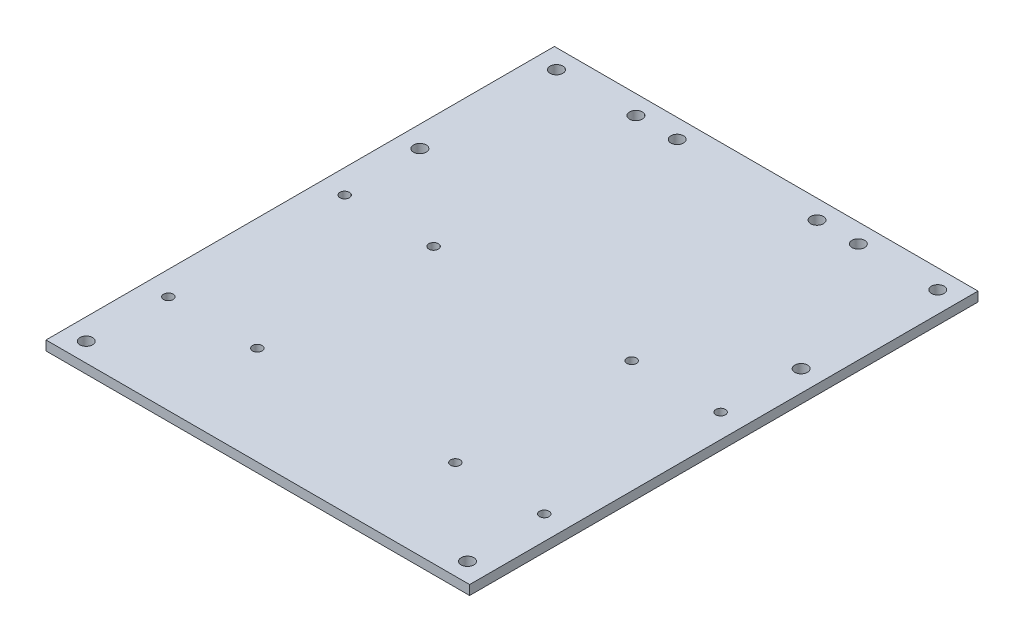
from build123d import *

# Parameters (mm, degrees)
ESQUISSE1_W             = 133.33
ESQUISSE1_H             = 160
BOSS_EXTRU_1_DEPTH      = 3
ESQUISSE2_R             = 2
ENL_V_MAT_EXTRU_1_DEPTH = 105.178799307
ESQUISSE3_R             = 2
ESQUISSE3_R_2           = 1.5
ENL_V_MAT_EXTRU_2_DEPTH = 105.178799307
ESQUISSE4_R             = 2
ENL_V_MAT_EXTRU_3_DEPTH = 3.175
ESQUISSE5_R             = 2
ENL_V_MAT_EXTRU_4_DEPTH = 105.178799307


with BuildPart() as part:
    # Esquisse1 → Boss.-Extru.1 (new body)
    with BuildSketch(Plane(origin=(0, 0, 0), x_dir=(1, 0, 0), z_dir=(0, 1, 0))):
        Rectangle(ESQUISSE1_W, ESQUISSE1_H)
    extrude(amount=BOSS_EXTRU_1_DEPTH)

    # Esquisse2 → Enlèv. mat.-Extru.1 (cut, through all)
    with BuildSketch(Plane(origin=(0, 3, 0), x_dir=(1, 0, 0), z_dir=(0, 1, 0))):
        with Locations(Location((-60, 74, 0), (0, 0, 270))):
            Circle(ESQUISSE2_R)
        with Locations(Location((60, 74, 0), (0, 0, 90))):
            Circle(ESQUISSE2_R)
        with Locations(Location((60, -74, 0), (0, 0, 270))):
            Circle(ESQUISSE2_R)
        with Locations(Location((-60, -74, 0), (0, 0, 90))):
            Circle(ESQUISSE2_R)
    extrude(amount=-ENL_V_MAT_EXTRU_1_DEPTH, mode=Mode.SUBTRACT)

    # Esquisse3 → Enlèv. mat.-Extru.2 (cut, through all)
    with BuildSketch(Plane(origin=(0, 3, 0), x_dir=(1, 0, 0), z_dir=(0, 1, 0))):
        with Locations(Location((-60, 31, 0), (0, 0, 270))):
            Circle(ESQUISSE3_R)
        with Locations(Location((60, 31, 0), (0, 0, 90))):
            Circle(ESQUISSE3_R)
        with Locations(Location((-59.165, 6.5, 0), (0, 0, 270))):
            Circle(ESQUISSE3_R_2)
        with Locations(Location((-31.165, 6.5, 0), (0, 0, 270))):
            Circle(ESQUISSE3_R_2)
        with Locations(Location((-59.165, -49, 0), (0, 0, 270))):
            Circle(ESQUISSE3_R_2)
        with Locations(Location((-31.165, -49, 0), (0, 0, 270))):
            Circle(ESQUISSE3_R_2)
        with Locations(Location((31.165, -49, 0), (0, 0, 90))):
            Circle(ESQUISSE3_R_2)
        with Locations(Location((59.165, -49, 0), (0, 0, 90))):
            Circle(ESQUISSE3_R_2)
        with Locations(Location((59.165, 6.5, 0), (0, 0, 90))):
            Circle(ESQUISSE3_R_2)
        with Locations(Location((31.165, 6.5, 0), (0, 0, 90))):
            Circle(ESQUISSE3_R_2)
    extrude(amount=-ENL_V_MAT_EXTRU_2_DEPTH, mode=Mode.SUBTRACT)

    # Esquisse4 → Enlèv. mat.-Extru.3 (cut)
    with BuildSketch(Plane(origin=(0, 3, 0), x_dir=(1, 0, 0), z_dir=(0, 1, 0))):
        with Locations(Location((-35, 74, 0), (0, 0, 270))):
            Circle(ESQUISSE4_R)
        with Locations(Location((35, 74, 0), (0, 0, 270))):
            Circle(ESQUISSE4_R)
    extrude(amount=-ENL_V_MAT_EXTRU_3_DEPTH, mode=Mode.SUBTRACT)

    # Esquisse5 → Enlèv. mat.-Extru.4 (cut, through all)
    with BuildSketch(Plane(origin=(0, 3, 0), x_dir=(1, 0, 0), z_dir=(0, 1, 0))):
        with Locations(Location((-22, 74, 0), (0, 0, 270))):
            Circle(ESQUISSE5_R)
        with Locations(Location((22, 74, 0), (0, 0, 90))):
            Circle(ESQUISSE5_R)
    extrude(amount=-ENL_V_MAT_EXTRU_4_DEPTH, mode=Mode.SUBTRACT)


solid = part.part
